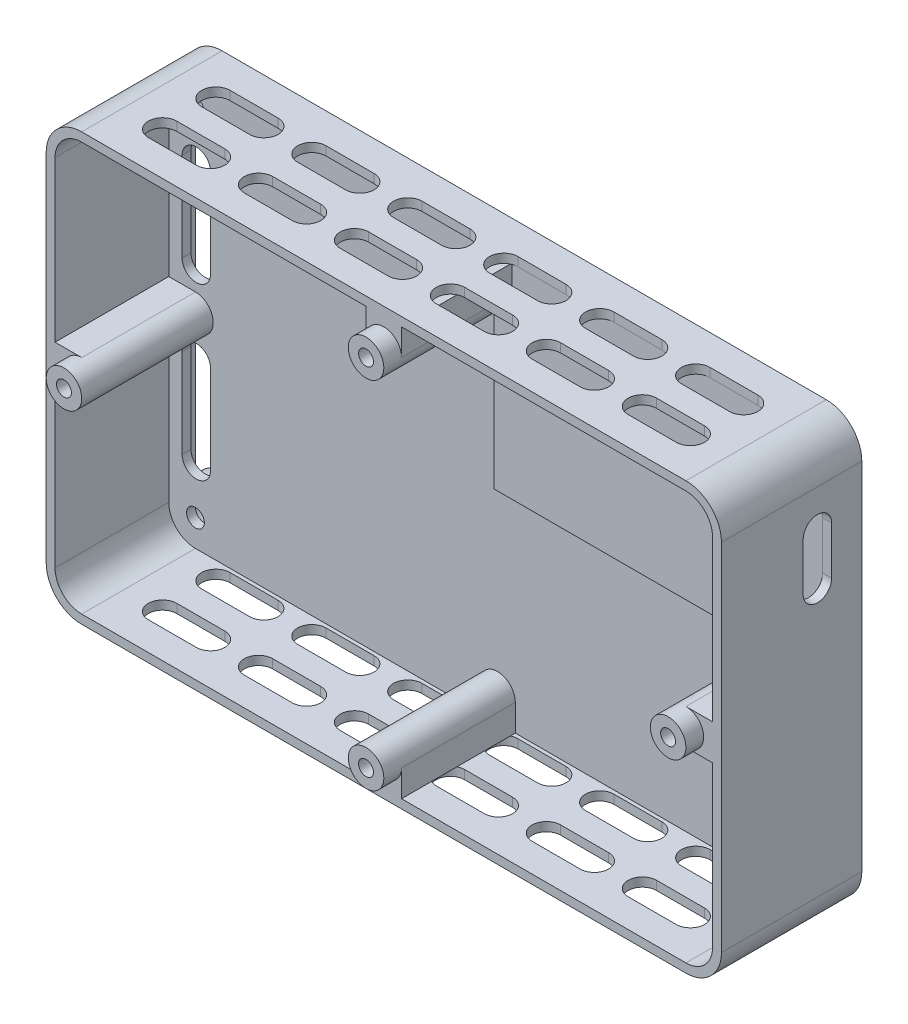
from build123d import *

# Parameters (mm, degrees)
SKETCH1_R                    = 5.975914464
SKETCH1_R_2                  = 5.5
BOSS_EXTRUDE1_DEPTH          = 5
BOSS_EXTRUDE2_DEPTH          = 2.5
SKETCH3_R                    = 5
BOSS_EXTRUDE3_DEPTH          = 32
SKETCH5_R                    = 5
BOSS_EXTRUDE4_DEPTH          = 5
CUT_EXTRUDE1_DEPTH           = 5
TAP_DRILL_FOR_M5_TAP2_D      = 4.2
TAP_DRILL_FOR_M5_TAP2_DEPTH  = 20
TAP_DRILL_FOR_M5_TAP2_TIP    = 1.2618073
F_5_0_5_DIAMETER_HOLE1_D     = 5
F_5_0_5_DIAMETER_HOLE1_DEPTH = 2.5
F_5_0_5_DIAMETER_HOLE1_TIP   = 1.502151548
CUT_EXTRUDE4_DEPTH           = 2.5
CUT_EXTRUDE5_START           = -2.5
CUT_EXTRUDE5_DEPTH           = 2.5
CUT_EXTRUDE7_DEPTH           = 2.5
BOSS_EXTRUDE5_DEPTH          = 1


with BuildPart() as part:
    # Sketch1 → Boss-Extrude1 (new body)
    with BuildSketch(Plane.XY):
        with BuildLine():
            ThreePointArc((-95.175936119, -194.891398577), (-92.247003931, -201.962466389), (-85.175936119, -204.891398577))
            Line((-85.175936119, -204.891398577), (84.824063881, -204.891398577))
            ThreePointArc((84.824063881, -204.891398577), (91.895131693, -201.962466389), (94.824063881, -194.891398577))
            Line((94.824063881, -194.891398577), (94.824063881, -94.891398577))
            ThreePointArc((94.824063881, -94.891398577), (91.895131693, -87.820330766), (84.824063881, -84.891398577))
            Line((84.824063881, -84.891398577), (-85.175936119, -84.891398577))
            ThreePointArc((-85.175936119, -84.891398577), (-92.247003931, -87.820330766), (-95.175936119, -94.891398577))
            Line((-95.175936119, -94.891398577), (-95.175936119, -194.891398577))
        make_face()
        with Locations((84.824063881, -194.891398577)):
            Circle(SKETCH1_R, mode=Mode.SUBTRACT)
        with Locations((-85.175936119, -94.891398577)):
            Circle(SKETCH1_R_2, mode=Mode.SUBTRACT)
        with BuildLine():
            Line((92.324063881, -94.891398577), (92.324063881, -194.891398577))
            ThreePointArc((92.324063881, -194.891398577), (79.520763022, -189.588097719), (84.824063881, -202.391398577))
            Line((84.824063881, -202.391398577), (-85.175936119, -202.391398577))
            ThreePointArc((-85.175936119, -202.391398577), (-79.87263526, -189.588097719), (-92.675936119, -194.891398577))
            Line((-92.675936119, -194.891398577), (-92.675936119, -94.891398577))
            ThreePointArc((-92.675936119, -94.891398577), (-79.87263526, -100.194699436), (-85.175936119, -87.391398577))
            Line((-85.175936119, -87.391398577), (84.824063881, -87.391398577))
            ThreePointArc((84.824063881, -87.391398577), (79.520763022, -100.194699436), (92.324063881, -94.891398577))
        make_face(mode=Mode.SUBTRACT)
        with Locations((84.824063881, -94.891398577)):
            Circle(SKETCH1_R, mode=Mode.SUBTRACT)
        with Locations((-85.175936119, -194.891398577)):
            Circle(SKETCH1_R, mode=Mode.SUBTRACT)
    extrude(amount=BOSS_EXTRUDE1_DEPTH)

    # Sketch2 → Boss-Extrude2 (add)
    with BuildSketch(Plane.XY.offset(5)):
        with BuildLine():
            Line((-95.175936119, -94.891398577), (-95.175936119, -194.891398577))
            ThreePointArc((-95.175936119, -194.891398577), (-92.247003931, -201.962466389), (-85.175936119, -204.891398577))
            Line((-85.175936119, -204.891398577), (84.824063881, -204.891398577))
            ThreePointArc((84.824063881, -204.891398577), (91.895131693, -201.962466389), (94.824063881, -194.891398577))
            Line((94.824063881, -194.891398577), (94.824063881, -94.891398577))
            ThreePointArc((94.824063881, -94.891398577), (91.895131693, -87.820330766), (84.824063881, -84.891398577))
            Line((84.824063881, -84.891398577), (-85.175936119, -84.891398577))
            ThreePointArc((-85.175936119, -84.891398577), (-92.247003931, -87.820330766), (-95.175936119, -94.891398577))
        make_face()
    extrude(amount=BOSS_EXTRUDE2_DEPTH)

    # Sketch3 → Boss-Extrude3 (add)
    # profile 1 of 9: a face of its own
    with BuildSketch(Plane.XY.offset(7.5)):
        with BuildLine():
            Line((84.824063881, -84.891398577), (-85.175936119, -84.891398577))
            ThreePointArc((-85.175936119, -84.891398577), (-92.247003931, -87.820330766), (-95.175936119, -94.891398577))
            Line((-95.175936119, -94.891398577), (-95.175936119, -194.891398577))
            ThreePointArc((-95.175936119, -194.891398577), (-92.247003931, -201.962466389), (-85.175936119, -204.891398577))
            Line((-85.175936119, -204.891398577), (84.824063881, -204.891398577))
            ThreePointArc((84.824063881, -204.891398577), (91.895131693, -201.962466389), (94.824063881, -194.891398577))
            Line((94.824063881, -194.891398577), (94.824063881, -94.891398577))
            ThreePointArc((94.824063881, -94.891398577), (91.895131693, -87.820330766), (84.824063881, -84.891398577))
        make_face()
        with BuildLine():
            ThreePointArc((92.324063881, -94.891398577), (90.12736474, -89.588097719), (84.824063881, -87.391398577))
            Line((84.824063881, -87.391398577), (-85.175936119, -87.391398577))
            ThreePointArc((-85.175936119, -87.391398577), (-90.479236978, -89.588097719), (-92.675936119, -94.891398577))
            Line((-92.675936119, -94.891398577), (-92.675936119, -194.891398577))
            ThreePointArc((-92.675936119, -194.891398577), (-90.479236978, -200.194699436), (-85.175936119, -202.391398577))
            Line((-85.175936119, -202.391398577), (84.824063881, -202.391398577))
            ThreePointArc((84.824063881, -202.391398577), (90.12736474, -200.194699436), (92.324063881, -194.891398577))
            Line((92.324063881, -194.891398577), (92.324063881, -94.891398577))
        make_face(mode=Mode.SUBTRACT)
    # profile 2 of 9: a face of its own
    with BuildSketch(Plane.XY.offset(7.5)):
        with BuildLine():
            Line((4.824063881, -87.391398577), (-5.175936119, -87.391398577))
            Line((-5.175936119, -87.391398577), (-5.175936119, -94.891398577))
            ThreePointArc((-5.175936119, -94.891398577), (-0.175936119, -89.891398577), (4.824063881, -94.891398577))
            Line((4.824063881, -94.891398577), (4.824063881, -87.391398577))
        make_face()
    # profile 3 of 9: a face of its own
    with BuildSketch(Plane.XY.offset(7.5)):
        with Locations((-0.175936119, -94.891398577)):
            Circle(SKETCH3_R)
    # profile 4 of 9: a face of its own
    with BuildSketch(Plane.XY.offset(7.5)):
        with Locations((84.824063881, -144.891398577)):
            Circle(SKETCH3_R)
    # profile 5 of 9: a face of its own
    with BuildSketch(Plane.XY.offset(7.5)):
        with BuildLine():
            Line((92.324063881, -149.891398577), (92.324063881, -139.891398577))
            Line((92.324063881, -139.891398577), (84.824063881, -139.891398577))
            ThreePointArc((84.824063881, -139.891398577), (88.359597787, -141.355864672), (89.824063881, -144.891398577))
            ThreePointArc((89.824063881, -144.891398577), (88.359597787, -148.426932483), (84.824063881, -149.891398577))
            Line((84.824063881, -149.891398577), (92.324063881, -149.891398577))
        make_face()
    # profile 6 of 9: a face of its own
    with BuildSketch(Plane.XY.offset(7.5)):
        with Locations((-0.175936119, -194.891398577)):
            Circle(SKETCH3_R)
    # profile 7 of 9: a face of its own
    with BuildSketch(Plane.XY.offset(7.5)):
        with BuildLine():
            Line((-5.175936119, -194.891398577), (-5.175936119, -202.391398577))
            Line((-5.175936119, -202.391398577), (4.824063881, -202.391398577))
            Line((4.824063881, -202.391398577), (4.824063881, -194.891398577))
            ThreePointArc((4.824063881, -194.891398577), (-0.175936119, -199.891398577), (-5.175936119, -194.891398577))
        make_face()
    # profile 8 of 9: a face of its own
    with BuildSketch(Plane.XY.offset(7.5)):
        with BuildLine():
            Line((-85.175936119, -139.891398577), (-92.675936119, -139.891398577))
            Line((-92.675936119, -139.891398577), (-92.675936119, -149.891398577))
            Line((-92.675936119, -149.891398577), (-85.175936119, -149.891398577))
            ThreePointArc((-85.175936119, -149.891398577), (-90.175936119, -144.891398577), (-85.175936119, -139.891398577))
        make_face()
    # profile 9 of 9: a face of its own
    with BuildSketch(Plane.XY.offset(7.5)):
        with Locations((-85.175936119, -144.891398577)):
            Circle(SKETCH3_R)
    extrude(amount=BOSS_EXTRUDE3_DEPTH)

    # Sketch5 → Boss-Extrude4 (add)
    with BuildSketch(Plane.XY.offset(39.5)):
        with Locations(Location((-85.175936119, -144.891398577, 0), (0, 0, 90))):
            Circle(SKETCH5_R)
        with Locations((-0.175936119, -94.891398577)):
            Circle(SKETCH5_R)
        with Locations(Location((84.824063881, -144.891398577, 0), (0, 0, 270))):
            Circle(SKETCH5_R)
        with Locations((-0.175936119, -194.891398577)):
            Circle(SKETCH5_R)
    extrude(amount=BOSS_EXTRUDE4_DEPTH)

    # Sketch6 → Cut-Extrude1 (cut)
    with BuildSketch(Plane.XY.offset(7.5)):
        with BuildLine():
            Line((-80.93748893, -181.361482413), (-80.93748893, -156.297951813))
            ThreePointArc((-80.93748893, -156.297951813), (-84.93748893, -152.297951813), (-88.93748893, -156.297951813))
            Line((-88.93748893, -156.297951813), (-88.93748893, -181.361482413))
            ThreePointArc((-88.93748893, -181.361482413), (-84.93748893, -185.361482413), (-80.93748893, -181.361482413))
        make_face()
        with BuildLine():
            Line((-80.93748893, -133.484845342), (-80.93748893, -108.421314742))
            ThreePointArc((-80.93748893, -108.421314742), (-84.93748893, -104.421314742), (-88.93748893, -108.421314742))
            Line((-88.93748893, -108.421314742), (-88.93748893, -133.484845342))
            ThreePointArc((-88.93748893, -133.484845342), (-84.93748893, -137.484845342), (-80.93748893, -133.484845342))
        make_face()
    extrude(amount=-CUT_EXTRUDE1_DEPTH, mode=Mode.SUBTRACT)

    # Tap Drill for M5 Tap2
    with Locations(Plane.XY.offset(44.5)):
        with Locations((-0.175936119, -94.891398577), (-85.175936119, -144.891398577), (84.824063881, -144.891398577), (-0.175936119, -194.891398577)):
            Hole(TAP_DRILL_FOR_M5_TAP2_D / 2, depth=TAP_DRILL_FOR_M5_TAP2_DEPTH)
            with Locations((0, 0, -(TAP_DRILL_FOR_M5_TAP2_DEPTH + TAP_DRILL_FOR_M5_TAP2_TIP / 2))):  # 118° drill point
                Cone(0, TAP_DRILL_FOR_M5_TAP2_D / 2, TAP_DRILL_FOR_M5_TAP2_TIP, mode=Mode.SUBTRACT)

    # Ø5.0 (5) Diameter Hole1
    with Locations(Plane.XY.offset(7.5)):
        with Locations((-85.175936119, -94.891398577), (-85.175936119, -194.891398577), (84.824063881, -194.891398577), (84.824063881, -94.891398577)):
            Hole(F_5_0_5_DIAMETER_HOLE1_D / 2, depth=F_5_0_5_DIAMETER_HOLE1_DEPTH)
            with Locations((0, 0, -(F_5_0_5_DIAMETER_HOLE1_DEPTH + F_5_0_5_DIAMETER_HOLE1_TIP / 2))):  # 118° drill point
                Cone(0, F_5_0_5_DIAMETER_HOLE1_D / 2, F_5_0_5_DIAMETER_HOLE1_TIP, mode=Mode.SUBTRACT)

    # Sketch20 → Cut-Extrude4 (cut)
    with BuildSketch(Plane.XZ.offset(204.891398577)):
        with BuildLine():
            Line((-74.425936119, 31.5), (-60.925936119, 31.5))
            ThreePointArc((-60.925936119, 31.5), (-56.925936119, 27.5), (-60.925936119, 23.5))
            Line((-60.925936119, 23.5), (-74.425936119, 23.5))
            ThreePointArc((-74.425936119, 23.5), (-78.425936119, 27.5), (-74.425936119, 31.5))
        make_face()
        with BuildLine():
            Line((-47.425936119, 31.5), (-33.925936119, 31.5))
            ThreePointArc((-33.925936119, 31.5), (-29.925936119, 27.5), (-33.925936119, 23.5))
            Line((-33.925936119, 23.5), (-47.425936119, 23.5))
            ThreePointArc((-47.425936119, 23.5), (-51.425936119, 27.5), (-47.425936119, 31.5))
        make_face()
        with BuildLine():
            Line((-20.425936119, 31.5), (-6.925936119, 31.5))
            ThreePointArc((-6.925936119, 31.5), (-2.925936119, 27.5), (-6.925936119, 23.5))
            Line((-6.925936119, 23.5), (-20.425936119, 23.5))
            ThreePointArc((-20.425936119, 23.5), (-24.425936119, 27.5), (-20.425936119, 31.5))
        make_face()
        with BuildLine():
            Line((6.574063881, 31.5), (20.074063881, 31.5))
            ThreePointArc((20.074063881, 31.5), (24.074063881, 27.5), (20.074063881, 23.5))
            Line((20.074063881, 23.5), (6.574063881, 23.5))
            ThreePointArc((6.574063881, 23.5), (2.574063881, 27.5), (6.574063881, 31.5))
        make_face()
        with BuildLine():
            Line((33.574063881, 31.5), (47.074063881, 31.5))
            ThreePointArc((47.074063881, 31.5), (51.074063881, 27.5), (47.074063881, 23.5))
            Line((47.074063881, 23.5), (33.574063881, 23.5))
            ThreePointArc((33.574063881, 23.5), (29.574063881, 27.5), (33.574063881, 31.5))
        make_face()
        with BuildLine():
            Line((60.574063881, 31.5), (74.074063881, 31.5))
            ThreePointArc((74.074063881, 31.5), (78.074063881, 27.5), (74.074063881, 23.5))
            Line((74.074063881, 23.5), (60.574063881, 23.5))
            ThreePointArc((60.574063881, 23.5), (56.574063881, 27.5), (60.574063881, 31.5))
        make_face()
        with BuildLine():
            Line((-47.425936119, 16.5), (-33.925936119, 16.5))
            ThreePointArc((-33.925936119, 16.5), (-29.925936119, 12.5), (-33.925936119, 8.5))
            Line((-33.925936119, 8.5), (-47.425936119, 8.5))
            ThreePointArc((-47.425936119, 8.5), (-51.425936119, 12.5), (-47.425936119, 16.5))
        make_face()
        with BuildLine():
            Line((-20.425936119, 16.5), (-6.925936119, 16.5))
            ThreePointArc((-6.925936119, 16.5), (-2.925936119, 12.5), (-6.925936119, 8.5))
            Line((-6.925936119, 8.5), (-20.425936119, 8.5))
            ThreePointArc((-20.425936119, 8.5), (-24.425936119, 12.5), (-20.425936119, 16.5))
        make_face()
        with BuildLine():
            Line((6.574063881, 16.5), (20.074063881, 16.5))
            ThreePointArc((20.074063881, 16.5), (24.074063881, 12.5), (20.074063881, 8.5))
            Line((20.074063881, 8.5), (6.574063881, 8.5))
            ThreePointArc((6.574063881, 8.5), (2.574063881, 12.5), (6.574063881, 16.5))
        make_face()
        with BuildLine():
            Line((33.574063881, 16.5), (47.074063881, 16.5))
            ThreePointArc((47.074063881, 16.5), (51.074063881, 12.5), (47.074063881, 8.5))
            Line((47.074063881, 8.5), (33.574063881, 8.5))
            ThreePointArc((33.574063881, 8.5), (29.574063881, 12.5), (33.574063881, 16.5))
        make_face()
        with BuildLine():
            Line((60.574063881, 16.5), (74.074063881, 16.5))
            ThreePointArc((74.074063881, 16.5), (78.074063881, 12.5), (74.074063881, 8.5))
            Line((74.074063881, 8.5), (60.574063881, 8.5))
            ThreePointArc((60.574063881, 8.5), (56.574063881, 12.5), (60.574063881, 16.5))
        make_face()
        with BuildLine():
            Line((-74.425936119, 16.5), (-60.925936119, 16.5))
            ThreePointArc((-60.925936119, 16.5), (-56.925936119, 12.5), (-60.925936119, 8.5))
            Line((-60.925936119, 8.5), (-74.425936119, 8.5))
            ThreePointArc((-74.425936119, 8.5), (-78.425936119, 12.5), (-74.425936119, 16.5))
        make_face()
    extrude(amount=-CUT_EXTRUDE4_DEPTH, mode=Mode.SUBTRACT)

    # Sketch21 → Cut-Extrude5 (cut)
    with BuildSketch(Plane(origin=(0, -84.891398577, 0), x_dir=(1, 0, 0), z_dir=(0, 1, 0)).offset(CUT_EXTRUDE5_START)):
        with BuildLine():
            Line((74.074063881, -31.5), (60.574063881, -31.5))
            ThreePointArc((60.574063881, -31.5), (56.574063881, -27.5), (60.574063881, -23.5))
            Line((60.574063881, -23.5), (74.074063881, -23.5))
            ThreePointArc((74.074063881, -23.5), (78.074063881, -27.5), (74.074063881, -31.5))
        make_face()
        with BuildLine():
            Line((47.074063881, -31.5), (33.574063881, -31.5))
            ThreePointArc((33.574063881, -31.5), (29.574063881, -27.5), (33.574063881, -23.5))
            Line((33.574063881, -23.5), (47.074063881, -23.5))
            ThreePointArc((47.074063881, -23.5), (51.074063881, -27.5), (47.074063881, -31.5))
        make_face()
        with BuildLine():
            Line((20.074063881, -31.5), (6.574063881, -31.5))
            ThreePointArc((6.574063881, -31.5), (2.574063881, -27.5), (6.574063881, -23.5))
            Line((6.574063881, -23.5), (20.074063881, -23.5))
            ThreePointArc((20.074063881, -23.5), (24.074063881, -27.5), (20.074063881, -31.5))
        make_face()
        with BuildLine():
            Line((-6.925936119, -31.5), (-20.425936119, -31.5))
            ThreePointArc((-20.425936119, -31.5), (-24.425936119, -27.5), (-20.425936119, -23.5))
            Line((-20.425936119, -23.5), (-6.925936119, -23.5))
            ThreePointArc((-6.925936119, -23.5), (-2.925936119, -27.5), (-6.925936119, -31.5))
        make_face()
        with BuildLine():
            Line((-33.925936119, -31.5), (-47.425936119, -31.5))
            ThreePointArc((-47.425936119, -31.5), (-51.425936119, -27.5), (-47.425936119, -23.5))
            Line((-47.425936119, -23.5), (-33.925936119, -23.5))
            ThreePointArc((-33.925936119, -23.5), (-29.925936119, -27.5), (-33.925936119, -31.5))
        make_face()
        with BuildLine():
            Line((-60.925936119, -31.5), (-74.425936119, -31.5))
            ThreePointArc((-74.425936119, -31.5), (-78.425936119, -27.5), (-74.425936119, -23.5))
            Line((-74.425936119, -23.5), (-60.925936119, -23.5))
            ThreePointArc((-60.925936119, -23.5), (-56.925936119, -27.5), (-60.925936119, -31.5))
        make_face()
        with BuildLine():
            Line((47.074063881, -16.5), (33.574063881, -16.5))
            ThreePointArc((33.574063881, -16.5), (29.574063881, -12.5), (33.574063881, -8.5))
            Line((33.574063881, -8.5), (47.074063881, -8.5))
            ThreePointArc((47.074063881, -8.5), (51.074063881, -12.5), (47.074063881, -16.5))
        make_face()
        with BuildLine():
            Line((20.074063881, -16.5), (6.574063881, -16.5))
            ThreePointArc((6.574063881, -16.5), (2.574063881, -12.5), (6.574063881, -8.5))
            Line((6.574063881, -8.5), (20.074063881, -8.5))
            ThreePointArc((20.074063881, -8.5), (24.074063881, -12.5), (20.074063881, -16.5))
        make_face()
        with BuildLine():
            Line((-6.925936119, -16.5), (-20.425936119, -16.5))
            ThreePointArc((-20.425936119, -16.5), (-24.425936119, -12.5), (-20.425936119, -8.5))
            Line((-20.425936119, -8.5), (-6.925936119, -8.5))
            ThreePointArc((-6.925936119, -8.5), (-2.925936119, -12.5), (-6.925936119, -16.5))
        make_face()
        with BuildLine():
            Line((-33.925936119, -16.5), (-47.425936119, -16.5))
            ThreePointArc((-47.425936119, -16.5), (-51.425936119, -12.5), (-47.425936119, -8.5))
            Line((-47.425936119, -8.5), (-33.925936119, -8.5))
            ThreePointArc((-33.925936119, -8.5), (-29.925936119, -12.5), (-33.925936119, -16.5))
        make_face()
        with BuildLine():
            Line((-60.925936119, -16.5), (-74.425936119, -16.5))
            ThreePointArc((-74.425936119, -16.5), (-78.425936119, -12.5), (-74.425936119, -8.5))
            Line((-74.425936119, -8.5), (-60.925936119, -8.5))
            ThreePointArc((-60.925936119, -8.5), (-56.925936119, -12.5), (-60.925936119, -16.5))
        make_face()
        with BuildLine():
            Line((74.074063881, -16.5), (60.574063881, -16.5))
            ThreePointArc((60.574063881, -16.5), (56.574063881, -12.5), (60.574063881, -8.5))
            Line((60.574063881, -8.5), (74.074063881, -8.5))
            ThreePointArc((74.074063881, -8.5), (78.074063881, -12.5), (74.074063881, -16.5))
        make_face()
    extrude(amount=CUT_EXTRUDE5_DEPTH, mode=Mode.SUBTRACT)

    # Sketch24 → Cut-Extrude7 (cut)
    with BuildSketch(Plane(origin=(94.824063881, -110.067334696, 0), x_dir=(0, -1, 0), z_dir=(-1, 0, 0))):
        with BuildLine():
            Line((-4.425936119, 8.5), (9.074063881, 8.5))
            ThreePointArc((9.074063881, 8.5), (13.074063881, 12.5), (9.074063881, 16.5))
            Line((9.074063881, 16.5), (-4.425936119, 16.5))
            ThreePointArc((-4.425936119, 16.5), (-8.425936119, 12.5), (-4.425936119, 8.5))
        make_face()
    extrude(amount=CUT_EXTRUDE7_DEPTH, mode=Mode.SUBTRACT)


with BuildPart() as body_2:
    # Sketch25 → Boss-Extrude5 (new body)
    with BuildSketch(Plane.XY.offset(7.5)):
        with BuildLine():
            Line((84.824063881, -87.391398577), (4.824063881, -87.391398577))
            Line((4.824063881, -87.391398577), (4.824063881, -94.891398577))
            ThreePointArc((4.824063881, -94.891398577), (3.359597787, -98.426932483), (-0.175936119, -99.891398577))
            Line((-0.175936119, -99.891398577), (-0.175936119, -144.891398577))
            Line((-0.175936119, -144.891398577), (79.824063881, -144.891398577))
            ThreePointArc((79.824063881, -144.891398577), (81.288529975, -141.355864672), (84.824063881, -139.891398577))
            Line((84.824063881, -139.891398577), (92.324063881, -139.891398577))
            Line((92.324063881, -139.891398577), (92.324063881, -94.891398577))
            ThreePointArc((92.324063881, -94.891398577), (79.520763022, -100.194699436), (84.824063881, -87.391398577))
        make_face()
    extrude(amount=BOSS_EXTRUDE5_DEPTH)


solid = Compound([part.part, body_2.part])
